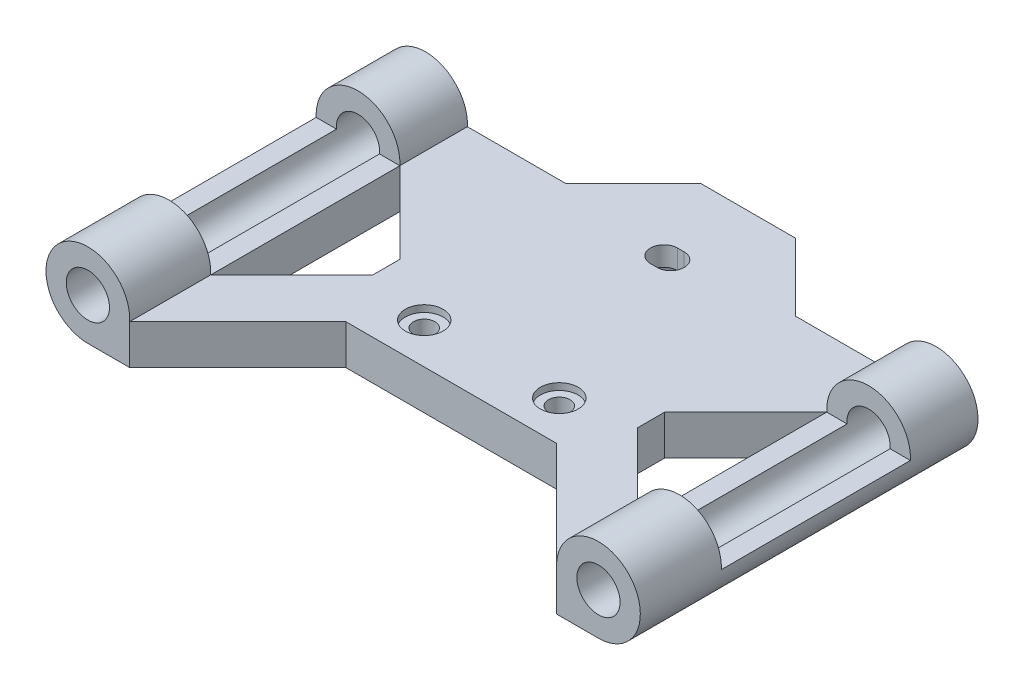
from build123d import *

# Parameters (mm, degrees)
SKETCH_1_R           = 3.1
SKETCH_1_R_2         = 1.6
EXTRUDE_1_DEPTH      = 25
EXTRUDE_2_DEPTH      = 2.945
CUT_EXTRUDE_1_DEPTH  = 56.771287036
CUT_EXTRUDE_START    = -1.5
CUT_EXTRUDE_4_DEPTH  = 1.5
SKETCH_6_R           = 0.8
CUT_EXTRUDE_5_DEPTH  = 56.771287036
CUT_EXTRUDE_6_DEPTH  = 56.771287036
SKETCH_9_W           = 14
SKETCH_9_H           = 3.255
CUT_EXTRUDE_9_DEPTH  = 47.133536551
SKETCH_10_R          = 1.4
CUT_EXTRUDE_11_DEPTH = 0.5


with BuildPart() as part:
    # 草图1 → 凸台-拉伸1 (new body)
    # profile 1 of 3: a face of its own
    with BuildSketch(Plane.XY):
        with Locations((-46.647778168, 5.529205914)):
            Circle(SKETCH_1_R)
        with Locations((-46.647778168, 5.529205914)):
            Circle(SKETCH_1_R_2, mode=Mode.SUBTRACT)
    # profile 2 of 3: a face of its own
    with BuildSketch(Plane.XY):
        with BuildLine():
            ThreePointArc((-43.551655593, 5.374205914), (-44.511250611, 3.283042519), (-46.647778168, 2.429205914))
            Line((-46.647778168, 2.429205914), (-8.847778168, 2.429205914))
            ThreePointArc((-8.847778168, 2.429205914), (-10.984305724, 3.283042519), (-11.943900743, 5.374205914))
            Line((-11.943900743, 5.374205914), (-43.551655593, 5.374205914))
        make_face()
    # profile 3 of 3: a face of its own
    with BuildSketch(Plane.XY):
        with Locations((-8.847778168, 5.529205914)):
            Circle(SKETCH_1_R)
        with Locations((-8.847778168, 5.529205914)):
            Circle(SKETCH_1_R_2, mode=Mode.SUBTRACT)
    extrude(amount=EXTRUDE_1_DEPTH)

    # 草图2 → 凸台-拉伸2 (add)
    with BuildSketch(Plane(origin=(0, 5.374205914, 0), x_dir=(1, 0, 0), z_dir=(0, 1, 0))):
        Polygon((-19.247778168, 0), (-24.247778168, 5), (-31.247778168, 5), (-36.247778168, 0), align=None)
    extrude(amount=-EXTRUDE_2_DEPTH)

    # 草图3 → 切除-拉伸1 (cut, through all)
    with BuildSketch(Plane(origin=(0, 5.374205914, 0), x_dir=(1, 0, 0), z_dir=(0, 1, 0))):
        with BuildLine():
            Line((-27.997778168, 0), (-27.497778168, 0))
            ThreePointArc((-27.497778168, 0), (-26.497778168, -1), (-27.497778168, -2))
            Line((-27.497778168, -2), (-27.997778168, -2))
            ThreePointArc((-27.997778168, -2), (-28.997778168, -1), (-27.997778168, 0))
        make_face()
    extrude(amount=-CUT_EXTRUDE_1_DEPTH, mode=Mode.SUBTRACT)

    # 草图5 → 切除-拉伸4 (cut)
    # profile 1 of 3: a face of its own
    with BuildSketch(Plane(origin=(0, 2.429205914, 0), x_dir=(-1, 0, 0), z_dir=(0, -1, 0)).offset(CUT_EXTRUDE_START)):
        Polygon((25.630642064, -1), (26.814210116, 1.05), (26.314210116, 1.05), (25.130642064, -1), (26.314210116, -3.05), (26.814210116, -3.05), align=None)
    # profile 2 of 3: a face of its own
    with BuildSketch(Plane(origin=(0, 2.429205914, 0), x_dir=(-1, 0, 0), z_dir=(0, -1, 0)).offset(CUT_EXTRUDE_START)):
        Polygon((28.68134622, -3.05), (29.864914271, -1), (28.68134622, 1.05), (26.814210116, 1.05), (25.630642064, -1), (26.814210116, -3.05), align=None)
        with BuildLine():
            ThreePointArc((27.497778168, -2), (26.497778168, -1), (27.497778168, 0))
            Line((27.497778168, 0), (27.997778168, 0))
            ThreePointArc((27.997778168, 0), (28.997778168, -1), (27.997778168, -2))
            Line((27.997778168, -2), (27.497778168, -2))
        make_face(mode=Mode.SUBTRACT)
    # profile 3 of 3: a face of its own
    with BuildSketch(Plane(origin=(0, 2.429205914, 0), x_dir=(-1, 0, 0), z_dir=(0, -1, 0)).offset(CUT_EXTRUDE_START)):
        Polygon((28.68134622, 1.05), (29.864914271, -1), (28.68134622, -3.05), (29.18134622, -3.05), (30.364914271, -1), (29.18134622, 1.05), align=None)
    extrude(amount=CUT_EXTRUDE_4_DEPTH, mode=Mode.SUBTRACT)

    # 草图6 → 切除-拉伸5 (cut, through all)
    with BuildSketch(Plane(origin=(0, 5.374205914, 0), x_dir=(1, 0, 0), z_dir=(0, 1, 0))):
        with Locations(Location((-32.747778168, -14, 0), (0, 0, 270))):
            Circle(SKETCH_6_R)
        with Locations(Location((-22.747778168, -14, 0), (0, 0, 270))):
            Circle(SKETCH_6_R)
    extrude(amount=-CUT_EXTRUDE_5_DEPTH, mode=Mode.SUBTRACT)

    # 草图7 → 切除-拉伸6 (cut, through all)
    with BuildSketch(Plane(origin=(0, 5.374205914, 0), x_dir=(1, 0, 0), z_dir=(0, 1, 0))):
        Polygon((-35.547778168, -17), (-43.547778168, -25), (-11.943900743, -25), (-19.943900743, -17), align=None)
        Polygon((-37.547778168, -13), (-37.547778168, -11), (-43.547778168, -5), (-43.547778168, -19), align=None)
        Polygon((-11.947778168, -5), (-17.947778168, -11), (-17.947778168, -13), (-11.947778168, -19), align=None)
    extrude(amount=-CUT_EXTRUDE_6_DEPTH, mode=Mode.SUBTRACT)

    # 草图9 → 切除-拉伸9 (cut, through all)
    with BuildSketch(Plane.ZY.offset(11.947778168)):
        with Locations((12, 7.001705914)):
            Rectangle(SKETCH_9_W, SKETCH_9_H)
    cut_extrude_9 = extrude(amount=-CUT_EXTRUDE_9_DEPTH, mode=Mode.SUBTRACT)

    # 镜向1: 切除-拉伸9 across plane
    add(cut_extrude_9.mirror(Plane(origin=(-27.747778168, 0, 0), x_dir=(0, 0, 1), z_dir=(1, 0, 0))), mode=Mode.SUBTRACT)

    # 草图10 → 切除-拉伸11 (cut)
    with BuildSketch(Plane(origin=(0, 5.374205914, 0), x_dir=(1, 0, 0), z_dir=(0, 1, 0))):
        with Locations(Location((-22.747778168, -14, 0), (0, 0, 270))):
            Circle(SKETCH_10_R)
        with Locations(Location((-32.747778168, -14, 0), (0, 0, 270))):
            Circle(SKETCH_10_R)
    extrude(amount=-CUT_EXTRUDE_11_DEPTH, mode=Mode.SUBTRACT)


solid = part.part
